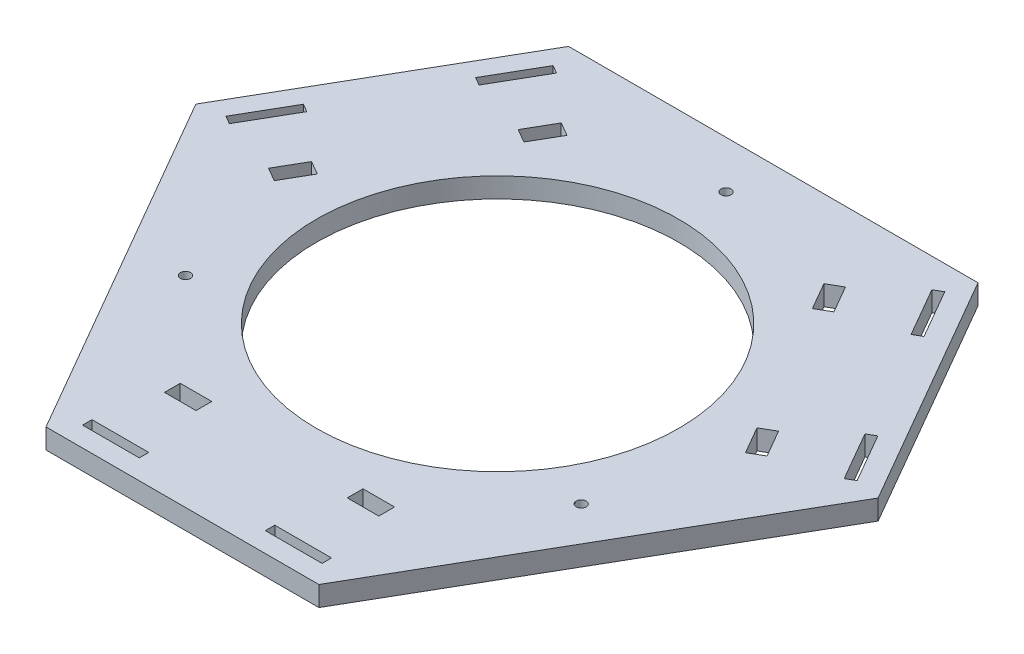
from build123d import *

# Parameters (mm, degrees)
BOSS_EXTRUDE1_DEPTH = 6.35
SKETCH2_W           = 18
SKETCH2_H           = 3
SKETCH2_W_2         = 10
SKETCH2_H_2         = 5
CUT_EXTRUDE1_DEPTH  = 148.509567486
SKETCH4_R           = 57.5
CUT_EXTRUDE2_DEPTH  = 148.509567486
SKETCH5_R           = 1.6
CUT_EXTRUDE3_DEPTH  = 148.509567486


with BuildPart() as part:
    # Sketch1 → Boss-Extrude1 (new body)
    with BuildSketch(Plane(origin=(0, 0, 0), x_dir=(1, 0, 0), z_dir=(0, 1, 0))):
        Polygon((64.951905284, 87.5), (-64.951905284, 87.5), (-108.253175473, 12.5), (-43.301270189, -100), (43.301270189, -100), (108.253175473, 12.5), align=None)
    extrude(amount=BOSS_EXTRUDE1_DEPTH)

    # Sketch2 → Cut-Extrude1 (cut, through all)
    with BuildSketch(Plane(origin=(0, 6.35, 0), x_dir=(1, 0, 0), z_dir=(0, 1, 0))):
        with Locations((-29, -92.2)):
            Rectangle(SKETCH2_W, SKETCH2_H)
        with Locations((29, -92.2)):
            Rectangle(SKETCH2_W, SKETCH2_H)
        Polygon((-62.146580335, 79.758965344), (-59.548504123, 78.258965344), (-68.548504123, 62.670508076), (-71.146580335, 64.170508076), align=None)
        Polygon((-97.548504123, 12.441034656), (-88.548504123, 28.029491924), (-91.146580335, 29.529491924), (-100.146580335, 13.941034656), align=None)
        Polygon((100.146580335, 13.941034656), (91.146580335, 29.529491924), (88.548504123, 28.029491924), (97.548504123, 12.441034656), align=None)
        Polygon((59.548504123, 78.258965344), (62.146580335, 79.758965344), (71.146580335, 64.170508076), (68.548504123, 62.670508076), align=None)
        with Locations((-29, -69.2)):
            Rectangle(SKETCH2_W_2, SKETCH2_H_2)
        with Locations((29, -69.2)):
            Rectangle(SKETCH2_W_2, SKETCH2_H_2)
        Polygon((79.094021451, 6.405136271), (74.094021451, 15.065390309), (69.763894432, 12.565390309), (74.763894432, 3.905136271), align=None)
        Polygon((40.763894432, 62.794863729), (45.094021451, 65.294863729), (50.094021451, 56.634609691), (45.763894432, 54.134609691), align=None)
        Polygon((-74.763894432, 3.905136271), (-69.763894432, 12.565390309), (-74.094021451, 15.065390309), (-79.094021451, 6.405136271), align=None)
        Polygon((-45.094021451, 65.294863729), (-40.763894432, 62.794863729), (-45.763894432, 54.134609691), (-50.094021451, 56.634609691), align=None)
    extrude(amount=-CUT_EXTRUDE1_DEPTH, mode=Mode.SUBTRACT)

    # Sketch4 → Cut-Extrude2 (cut, through all)
    with BuildSketch(Plane(origin=(0, 6.35, 0), x_dir=(1, 0, 0), z_dir=(0, 1, 0))):
        Circle(SKETCH4_R)
    extrude(amount=-CUT_EXTRUDE2_DEPTH, mode=Mode.SUBTRACT)

    # Sketch5 → Cut-Extrude3 (cut, through all)
    with BuildSketch(Plane(origin=(0, 6.35, 0), x_dir=(1, 0, 0), z_dir=(0, 1, 0))):
        with Locations((0, 72.5)):
            Circle(SKETCH5_R)
        with Locations((-62.786841774, -36.25)):
            Circle(SKETCH5_R)
        with Locations((62.786841774, -36.25)):
            Circle(SKETCH5_R)
    extrude(amount=-CUT_EXTRUDE3_DEPTH, mode=Mode.SUBTRACT)


solid = part.part
